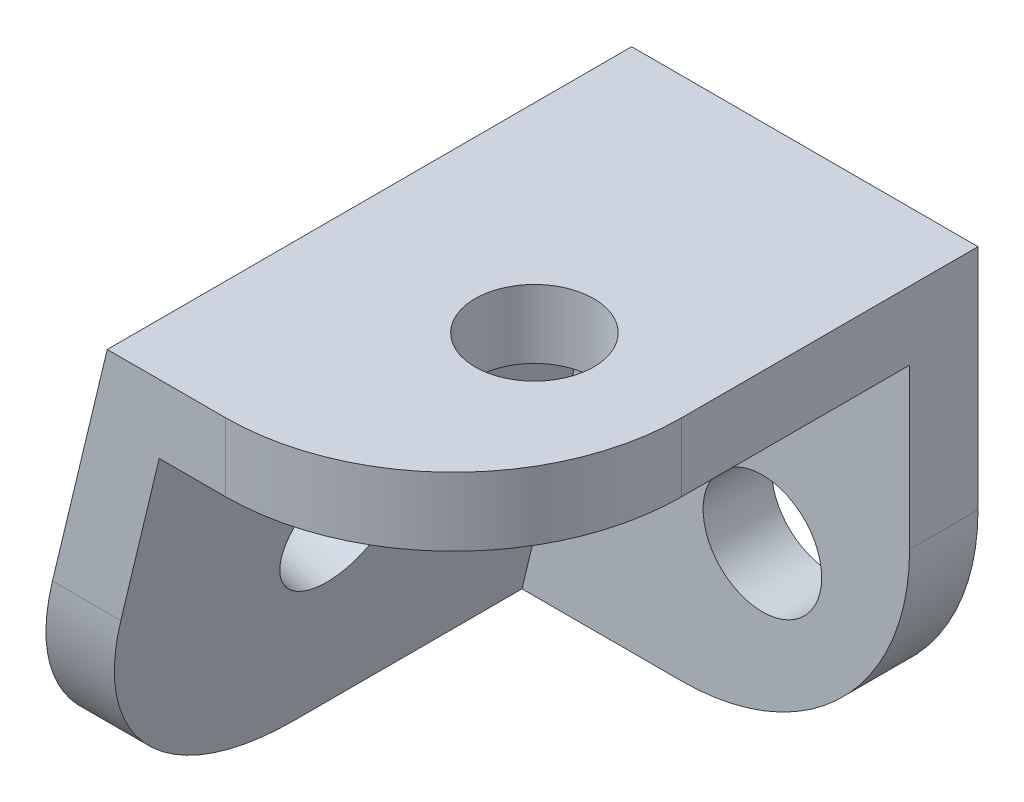
from build123d import *

# Parameters (mm, degrees)
BOSS_EXTRU_1_DEPTH      = 3
BOSS_EXTRU_2_DEPTH      = 20
ESQUISSE4_W             = 14.470789164
ESQUISSE4_H             = 3
BOSS_EXTRU_3_DEPTH      = 20
CONG_1_R                = 10
ESQUISSE5_R             = 2.6
ENL_V_MAT_EXTRU_1_DEPTH = 20
ESQUISSE6_R             = 2.6
ENL_V_MAT_EXTRU_2_DEPTH = 20
ESQUISSE7_R             = 2.6
ENL_V_MAT_EXTRU_3_DEPTH = 20


with BuildPart() as part:
    # Esquisse1 → Boss.-Extru.1 (new body)
    with BuildSketch(Plane.XY):
        Polygon((-44.709210836, 492.3), (-44.709210836, 472.3), (-64.709210836, 472.3), (-59.901201413, 492.3), align=None)
    extrude(amount=BOSS_EXTRU_1_DEPTH)

    # Esquisse3 → Boss.-Extru.2 (add)
    with BuildSketch(Plane.XY.offset(3)):
        Polygon((-59.901201413, 492.3), (-64.709210836, 472.3), (-61.709210836, 472.3), (-56.901201413, 492.3), align=None)
    extrude(amount=BOSS_EXTRU_2_DEPTH)

    # Esquisse4 → Boss.-Extru.3 (add)
    with BuildSketch(Plane.XY.offset(3)):
        with Locations((-51.944605418, 490.8)):
            Rectangle(ESQUISSE4_W, ESQUISSE4_H)
    extrude(amount=BOSS_EXTRU_3_DEPTH)

    # Congé1
    cong_1_edges = [part.edges().sort_by_distance(p)[0] for p in [
        (-63.209210836, 472.3, 23),
        (-44.709210836, 490.8, 23),
        (-44.709210836, 472.3, 1.5),
    ]]
    fillet(cong_1_edges, radius=CONG_1_R)

    # Esquisse5 → Enlèv. mat.-Extru.1 (cut)
    with BuildSketch(Plane.XY.offset(3)):
        with Locations((-51.165806832, 479.3)):
            Circle(ESQUISSE5_R)
    extrude(amount=-ENL_V_MAT_EXTRU_1_DEPTH, mode=Mode.SUBTRACT)

    # Esquisse6 → Enlèv. mat.-Extru.2 (cut)
    with BuildSketch(Plane.XZ.offset(-489.3)):
        with Locations(Location((-51.165806832, 13, 0), (0, 0, 270))):
            Circle(ESQUISSE6_R)
    extrude(amount=-ENL_V_MAT_EXTRU_2_DEPTH, mode=Mode.SUBTRACT)

    # Esquisse7 → Enlèv. mat.-Extru.3 (cut)
    with BuildSketch(Plane(origin=(-165.675566954, 39.828484352, 0), x_dir=(0, 0, -1), z_dir=(0.9722988712431988, -0.23374110673820636, 0))):
        with Locations(Location((-13, 453.53494557, 0), (0, 0, 90))):
            Circle(ESQUISSE7_R)
    extrude(amount=-ENL_V_MAT_EXTRU_3_DEPTH, mode=Mode.SUBTRACT)


solid = part.part
